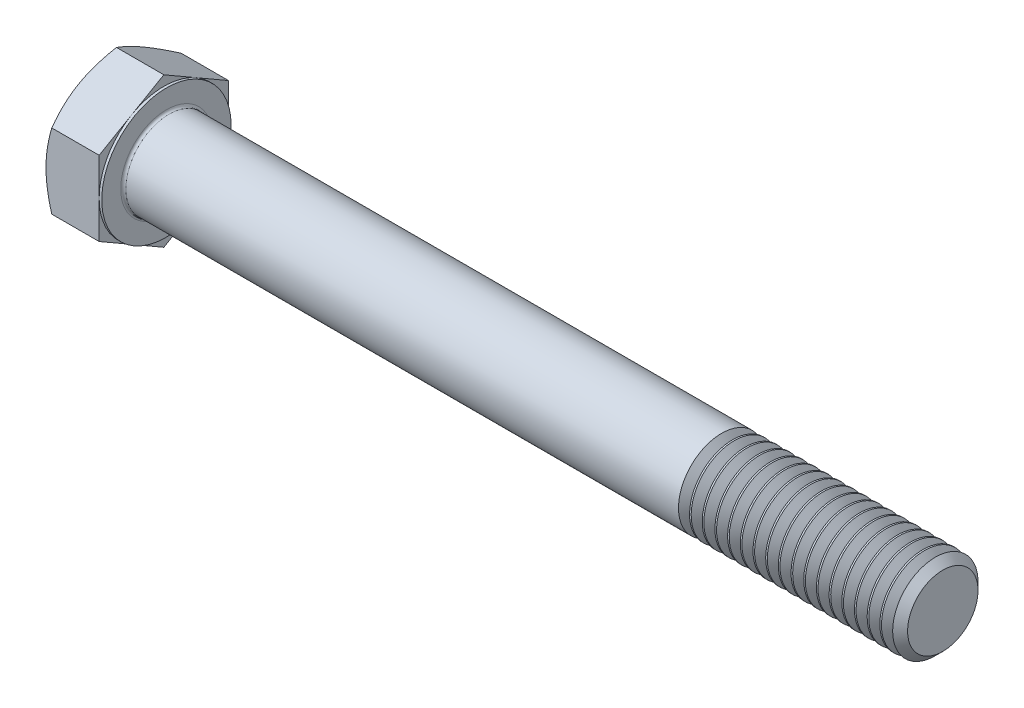
from build123d import *

# Parameters (mm, degrees)
BASEHEAD_DEPTH  = 8.2042
SKETCH4_W       = 0.381
SKETCH4_H       = 26.873522628
HEADFILLET_R    = 0.381
THDSCHPAT_COUNT = 17
THDSCHPAT_PITCH = 1.867647059


with BuildPart() as part:
    # Sketch1 → BaseHead (new body)
    with BuildSketch(Plane(origin=(0, 0, 0), x_dir=(0, 0, -1), z_dir=(1, 0, 0))):
        Polygon((9.525, 5.499261314), (9.525, -5.499261314), (0, -10.998522628), (-9.525, -5.499261314), (-9.525, 5.499261314), (0, 10.998522628), align=None)
    extrude(amount=BASEHEAD_DEPTH)

    # BodySke → BaseBody (revolve)
    with BuildSketch(Plane.XY, mode=Mode.PRIVATE) as basebody_sk:
        Polygon((0, 0), (122.5042, 0), (122.5042, 5.18668), (121.34088, 6.35), (0, 6.35), align=None)
    revolve(basebody_sk.sketch.rotate(Axis((0, 0, 0), (1, 0, 0)), 90), axis=Axis((0, 0, 0), (1, 0, 0)))

    # Sketch3 → HeadChamfer (revolve, cut)
    with BuildSketch(Plane.XY):
        Polygon((0, 9.525), (4.516912895, 17.348522628), (4.516912895, 23.698522628), (-12.7, 23.698522628), (-12.7, 9.525), align=None)
    revolve(axis=Axis((0, 0, 0), (1, 0, 0)), mode=Mode.SUBTRACT)

    # Sketch4 → BearingFace (revolve, cut)
    with BuildSketch(Plane.XY, mode=Mode.PRIVATE) as bearingface_sk:
        with Locations((8.0137, 22.961761314)):
            Rectangle(SKETCH4_W, SKETCH4_H)
    revolve(bearingface_sk.sketch.rotate(Axis((0, 0, 0), (1, 0, 0)), 270), axis=Axis((0, 0, 0), (1, 0, 0)), mode=Mode.SUBTRACT)

    # HeadFillet
    headfillet_edges = [part.edges().sort_by_distance(p)[0] for p in [
        (8.2042, 0, -6.35),
    ]]
    fillet(headfillet_edges, radius=HEADFILLET_R)

    # ThdSchSke → ThreadSchematic (revolve, cut)
    with BuildSketch(Plane.XY):
        Polygon((90.7542, -5.18668), (89.939634567, -6.35), (89.939634567, -7.9375), (91.568765433, -7.9375), (91.568765433, -6.35), align=None)
    threadschematic = revolve(axis=Axis((-3.175, 0, 0), (1, 0, 0)), mode=Mode.SUBTRACT)

    # ThdSchPat: ThreadSchematic ×17
    with Locations(*[(i * THDSCHPAT_PITCH, 0, 0) for i in range(1, THDSCHPAT_COUNT)]):
        add(threadschematic, mode=Mode.SUBTRACT)


solid = part.part
